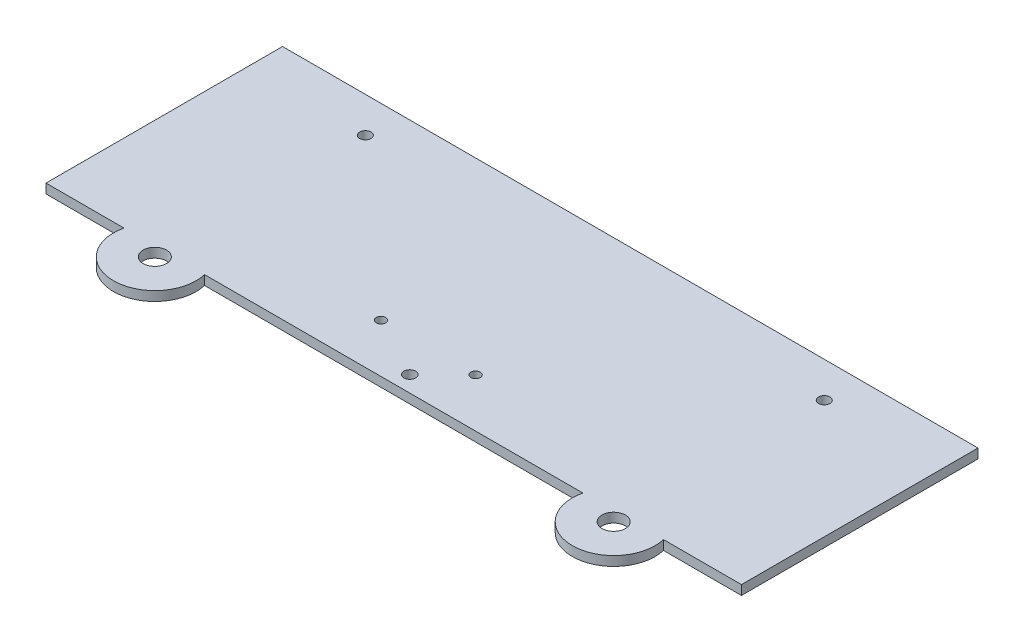
from build123d import *

# Parameters (mm, degrees)
SKETCH1_R               = 22.225
SKETCH1_W               = 373.38
SKETCH1_H               = 127
BOSS_EXTRUDE1_DEPTH     = 5.07492
SKETCH1_5_R             = 6.2865
CUT_EXTRUDE1_DEPTH      = 208.664293845
CUT_EXTRUDE2_DEPTH      = 208.664293845
CUT_EXTRUDE2_DEPTH_BACK = 208.664293845
SKETCH1_7_R             = 3.048
SKETCH1_8_R             = 2.54
SKETCH1_8_R_2           = 3.175
CUT_EXTRUDE3_DEPTH      = 208.664293845


with BuildPart() as part:
    # Sketch1 → Boss-Extrude1 (new body)
    with BuildSketch(Plane(origin=(0, 0, 0), x_dir=(1, 0, 0), z_dir=(0, 1, 0))):
        with Locations((-123.19, -68.58)):
            Circle(SKETCH1_R)
        with Locations((123.19, -68.58)):
            Circle(SKETCH1_R)
        Rectangle(SKETCH1_W, SKETCH1_H)
    extrude(amount=BOSS_EXTRUDE1_DEPTH)

    # Sketch1<5> → Cut-Extrude1 (cut, through all)
    with BuildSketch(Plane(origin=(0, 0, 0), x_dir=(1, 0, 0), z_dir=(0, 1, 0))):
        with Locations(Location((-123.19, -68.58, 0), (0, 0, 90))):
            Circle(SKETCH1_5_R)
        with Locations(Location((123.19, -68.58, 0), (0, 0, 90))):
            Circle(SKETCH1_5_R)
    extrude(amount=CUT_EXTRUDE1_DEPTH, mode=Mode.SUBTRACT)

    # Sketch1<7> → Cut-Extrude2 (cut, two sides: drawn at the far end of the back side and taken through both)
    with BuildSketch(Plane(origin=(0, 0, 0), x_dir=(1, 0, 0), z_dir=(0, 1, 0)).offset(-CUT_EXTRUDE2_DEPTH_BACK)):
        with Locations(Location((-123.19, 44.45, 0), (0, 0, 90))):
            Circle(SKETCH1_7_R)
        with Locations(Location((123.19, 44.45, 0), (0, 0, 90))):
            Circle(SKETCH1_7_R)
    extrude(amount=CUT_EXTRUDE2_DEPTH + CUT_EXTRUDE2_DEPTH_BACK, mode=Mode.SUBTRACT)

    # Sketch1<8> → Cut-Extrude3 (cut, through all)
    with BuildSketch(Plane(origin=(0, 0, 0), x_dir=(1, 0, 0), z_dir=(0, 1, 0))):
        with Locations(Location((-33.02, -37.338, 0), (0, 0, 90))):
            Circle(SKETCH1_8_R)
        with Locations(Location((17.78, -37.338, 0), (0, 0, 90))):
            Circle(SKETCH1_8_R)
        with Locations(Location((0, -54.864, 0), (0, 0, 90))):
            Circle(SKETCH1_8_R_2)
    extrude(amount=CUT_EXTRUDE3_DEPTH, mode=Mode.SUBTRACT)


solid = part.part
